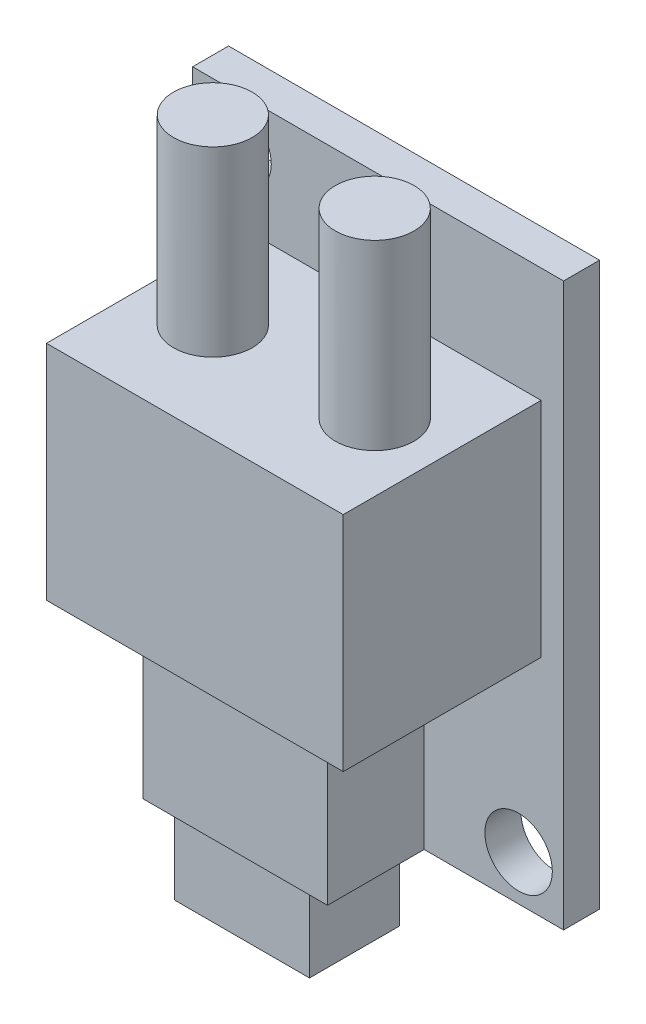
from build123d import *

# Parameters (mm, degrees)
SKETCH1_W           = 16.5
SKETCH1_H           = 25
BOSS_EXTRUDE1_DEPTH = 1.6
SKETCH2_R           = 1.5
CUT_EXTRUDE1_DEPTH  = 16.062287343
SKETCH3_W           = 13.2
SKETCH3_H           = 9.9
BOSS_EXTRUDE2_DEPTH = 8.8
SKETCH4_R           = 1.75
BOSS_EXTRUDE3_DEPTH = 8.1
SKETCH5_W           = 8.2
SKETCH5_H           = 5.602380094
BOSS_EXTRUDE4_DEPTH = 4.3
SKETCH6_W           = 6
SKETCH6_H           = 4
BOSS_EXTRUDE5_DEPTH = 3.5


with BuildPart() as part:
    # Sketch1 → Boss-Extrude1 (new body)
    with BuildSketch(Plane.XY):
        Rectangle(SKETCH1_W, SKETCH1_H)
    extrude(amount=BOSS_EXTRUDE1_DEPTH)

    # Sketch2 → Cut-Extrude1 (cut, through all)
    with BuildSketch(Plane.XY.offset(1.6)):
        with Locations((-6.25, 10.5)):
            Circle(SKETCH2_R)
        with Locations((6.25, -10.5)):
            Circle(SKETCH2_R)
    extrude(amount=-CUT_EXTRUDE1_DEPTH, mode=Mode.SUBTRACT)

    # Sketch3 → Boss-Extrude2 (add)
    with BuildSketch(Plane.XY.offset(1.6)):
        with Locations((0.65, 2.45)):
            Rectangle(SKETCH3_W, SKETCH3_H)
    extrude(amount=BOSS_EXTRUDE2_DEPTH)

    # Sketch4 → Boss-Extrude3 (add)
    with BuildSketch(Plane(origin=(0, 7.4, 0), x_dir=(1, 0, 0), z_dir=(0, 1, 0))):
        with Locations((-2.95, -6)):
            Circle(SKETCH4_R)
        with Locations((4.25, -6)):
            Circle(SKETCH4_R)
    extrude(amount=BOSS_EXTRUDE3_DEPTH)

    # Sketch5 → Boss-Extrude4 (add)
    with BuildSketch(Plane.XY.offset(1.6)):
        with Locations((-2.05, -9.698809953)):
            Rectangle(SKETCH5_W, SKETCH5_H)
    extrude(amount=BOSS_EXTRUDE4_DEPTH)

    # Sketch6 → Boss-Extrude5 (add)
    with BuildSketch(Plane(origin=(0, -12.5, 0), x_dir=(-1, 0, 0), z_dir=(0, -1, 0))):
        with Locations((2.05, -3.6)):
            Rectangle(SKETCH6_W, SKETCH6_H)
    extrude(amount=BOSS_EXTRUDE5_DEPTH)


solid = part.part
